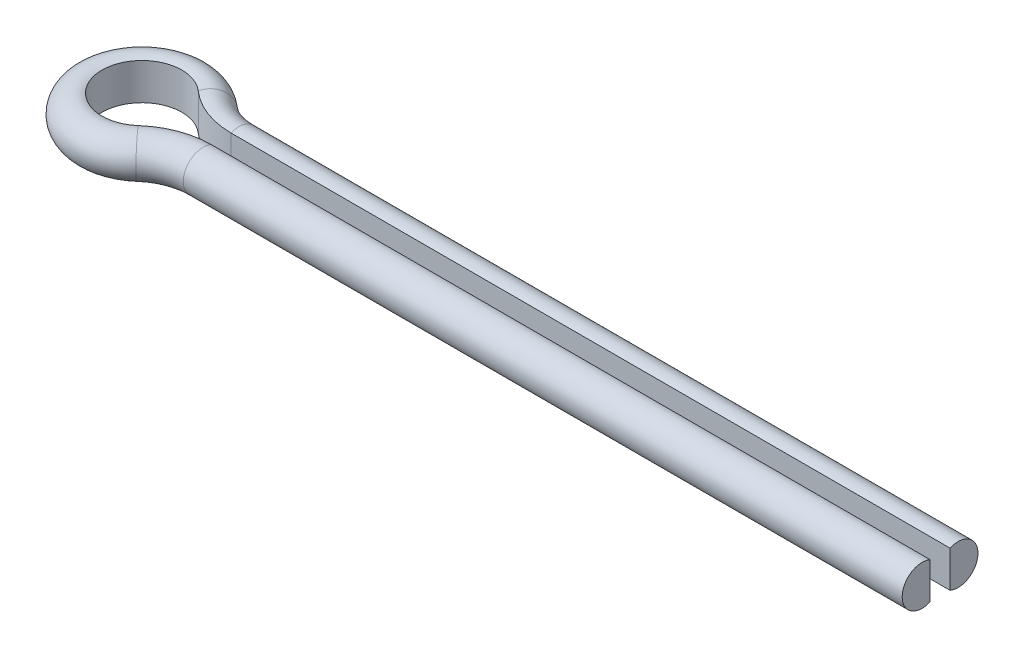
from build123d import *


with BuildPart() as part:
    # Sweep1: sweep along a path in Sketch1
    with BuildLine(Plane(origin=(0, 0, 0), x_dir=(1, 0, 0), z_dir=(0, 1, 0))) as sweep1_path:
        Line((0, 0), (-90.078432584, 0))
        ThreePointArc((-90.078432584, 0), (-93.613966489, 0.645856533), (-96.692810861, 2.5))
        ThreePointArc((-96.692810861, 2.5), (-105, -1.25), (-96.692810861, -5))
        ThreePointArc((-96.692810861, -5), (-93.613966489, -3.145856533), (-90.078432584, -2.5))
        Line((-90.078432584, -2.5), (0, -2.5))
    # Sketch2 → Sweep1 (sweep)
    with BuildSketch(Plane(origin=(0, 0, 0), x_dir=(0, 0, -1), z_dir=(1, 0, 0))):
        with BuildLine():
            Line((0, -2.291287847), (0, 2.291287847))
            ThreePointArc((0, 2.291287847), (3.5, 0), (0, -2.291287847))
        make_face()
    sweep(path=sweep1_path.line)


solid = part.part
